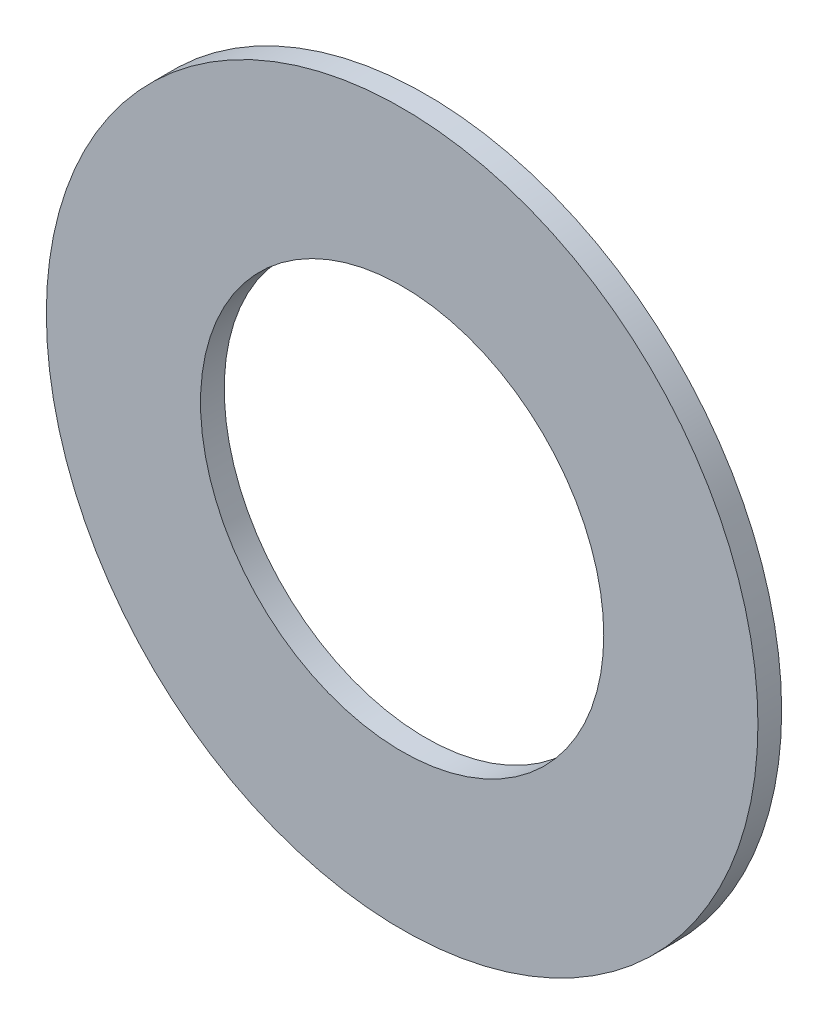
from build123d import *

# Parameters (mm, degrees)
ESQUISSE1_R        = 15
ESQUISSE1_R_2      = 8.5
BOSS_EXTRU_1_DEPTH = 1


with BuildPart() as part:
    # Esquisse1 → Boss.-Extru.1 (new body)
    with BuildSketch(Plane.XY):
        Circle(ESQUISSE1_R)
        Circle(ESQUISSE1_R_2, mode=Mode.SUBTRACT)
    extrude(amount=BOSS_EXTRU_1_DEPTH)


solid = part.part
